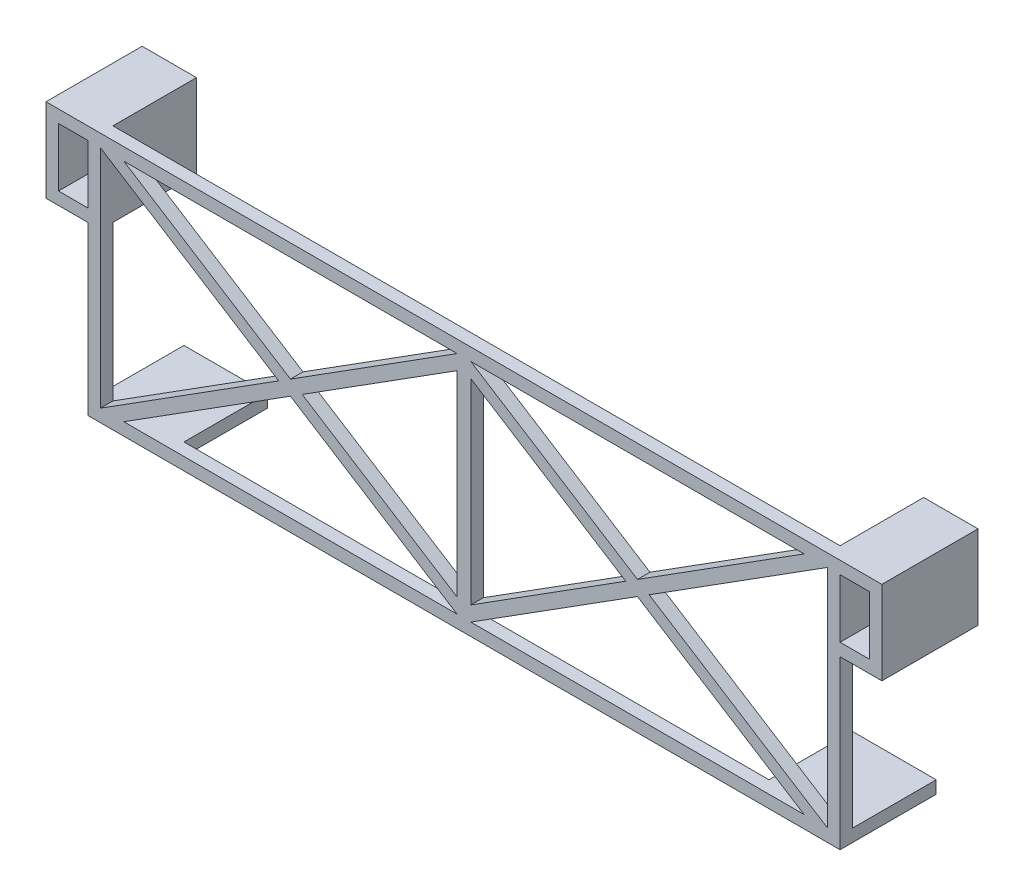
from build123d import *

# Parameters (mm, degrees)
CROQUIS1_W              = 180
CROQUIS1_H              = 60
SALIENTE_EXTRUIR1_DEPTH = 3
CROQUIS2_W              = 20
CROQUIS2_H              = 3
CROQUIS2_W_2            = 13
CROQUIS2_H_2            = 20
CROQUIS2_W_3            = 7
CROQUIS2_H_3            = 14
SALIENTE_EXTRUIR2_DEPTH = 23


with BuildPart() as part:
    # Croquis1 → Saliente-Extruir1 (new body)
    with BuildSketch(Plane.XY):
        with Locations((-124.847250917, 17.903225806)):
            Rectangle(CROQUIS1_W, CROQUIS1_H)
        Polygon((-43.458800443, 44.903225806), (-123.208800443, 44.903225806), (-83.333800443, 19.678168249), align=None, mode=Mode.SUBTRACT)
        Polygon((-123.208800443, 41.353340922), (-123.208800443, -5.546889309), (-86.139575206, 17.903225806), align=None, mode=Mode.SUBTRACT)
        Polygon((-166.360701391, 19.678168249), (-126.485701391, 44.903225806), (-206.235701391, 44.903225806), align=None, mode=Mode.SUBTRACT)
        Polygon((-211.847250917, 44.903225806), (-169.166476154, 17.903225806), (-211.847250917, -9.096774194), align=None, mode=Mode.SUBTRACT)
        Polygon((-206.235701391, -9.096774194), (-166.360701391, 16.128283364), (-126.485701391, -9.096774194), align=None, mode=Mode.SUBTRACT)
        Polygon((-126.485701391, -5.546889309), (-163.554926629, 17.903225806), (-126.485701391, 41.353340922), align=None, mode=Mode.SUBTRACT)
        Polygon((-43.458800443, -9.096774194), (-83.333800443, 16.128283364), (-123.208800443, -9.096774194), align=None, mode=Mode.SUBTRACT)
        Polygon((-37.847250917, 44.903225806), (-80.52802568, 17.903225806), (-37.847250917, -9.096774194), align=None, mode=Mode.SUBTRACT)
    extrude(amount=SALIENTE_EXTRUIR1_DEPTH)

    # Croquis2 → Saliente-Extruir2 (add)
    # profile 1 of 4: a face of its own
    with BuildSketch(Plane.XY.offset(3)):
        with Locations((-204.847250917, -10.596774194)):
            Rectangle(CROQUIS2_W, CROQUIS2_H)
    # profile 2 of 4: a face of its own
    with BuildSketch(Plane.XY.offset(3)):
        with Locations((-218.347250917, 37.903225806)):
            Rectangle(CROQUIS2_W_2, CROQUIS2_H_2)
        with Locations((-218.347250917, 37.903225806)):
            Rectangle(CROQUIS2_W_3, CROQUIS2_H_3, mode=Mode.SUBTRACT)
    # profile 3 of 4: a face of its own
    with BuildSketch(Plane.XY.offset(3)):
        with Locations((-31.347250917, 37.903225806)):
            Rectangle(CROQUIS2_W_2, CROQUIS2_H_2)
        with Locations((-31.347250917, 37.903225806)):
            Rectangle(CROQUIS2_W_3, CROQUIS2_H_3, mode=Mode.SUBTRACT)
    # profile 4 of 4: a face of its own
    with BuildSketch(Plane.XY.offset(3)):
        with Locations((-44.847250917, -10.596774194)):
            Rectangle(CROQUIS2_W, CROQUIS2_H)
    extrude(amount=-SALIENTE_EXTRUIR2_DEPTH)


solid = part.part
